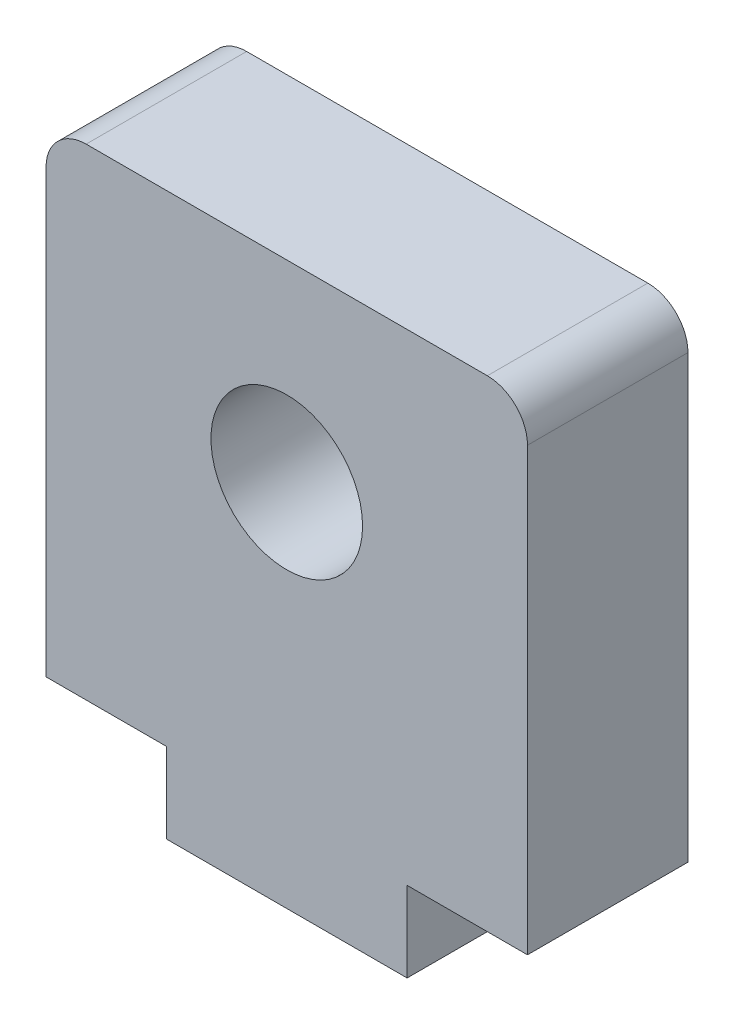
from build123d import *

# Parameters (mm, degrees)
SKETCH1_R           = 3
SKETCH1_W           = 9.525
SKETCH1_H           = 3.175
BOSS_EXTRUDE1_DEPTH = 6.35
FILLET1_R           = 1.5875


with BuildPart() as part:
    # Sketch1 → Boss-Extrude1 (new body)
    # profile 1 of 2: a face of its own
    with BuildSketch(Plane.XY):
        Polygon((9.525, 11.1125), (-9.525, 11.1125), (-9.525, -7.9375), (-4.7625, -7.9375), (4.7625, -7.9375), (9.525, -7.9375), align=None)
        with Locations((0, 3.4925)):
            Circle(SKETCH1_R, mode=Mode.SUBTRACT)
    # profile 2 of 2: a face of its own
    with BuildSketch(Plane.XY):
        with Locations((0, -9.525)):
            Rectangle(SKETCH1_W, SKETCH1_H)
    extrude(amount=BOSS_EXTRUDE1_DEPTH)

    # Fillet1
    fillet1_edges = [part.edges().sort_by_distance(p)[0] for p in [
        (-9.525, 11.1125, 3.175),
        (9.525, 11.1125, 3.175),
    ]]
    fillet(fillet1_edges, radius=FILLET1_R)


solid = part.part
